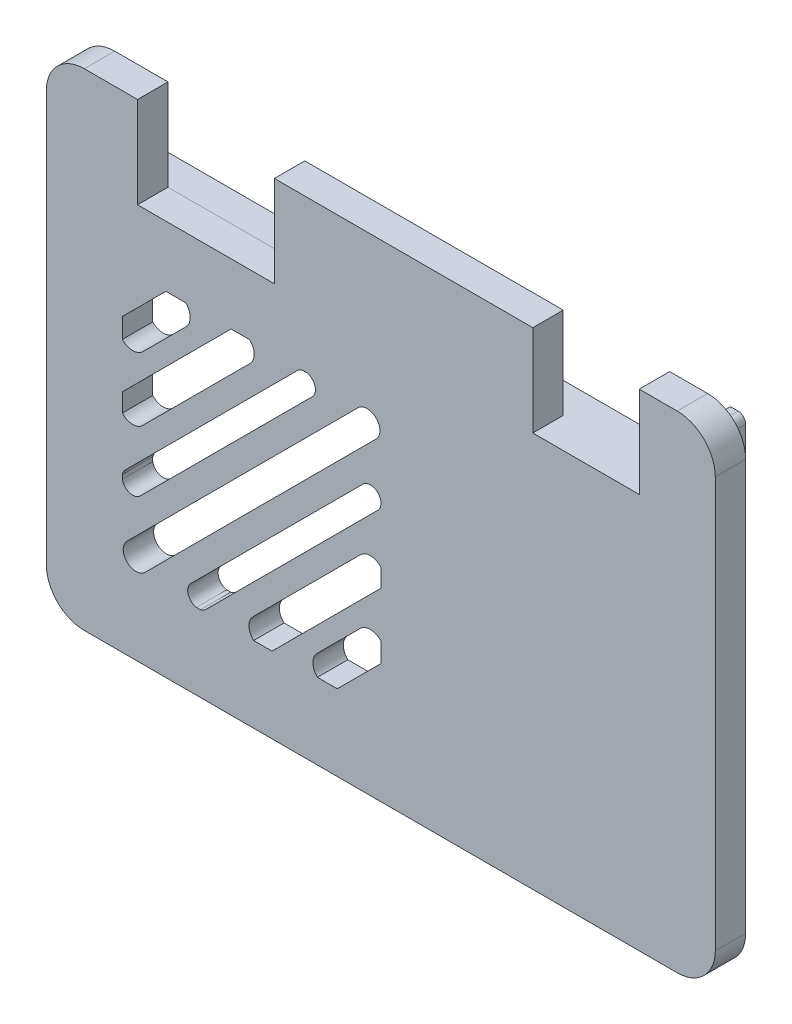
from build123d import *

# Parameters (mm, degrees)
BOSS_EXTRUDE1_DEPTH = 2
FILLET1_R           = 2.5
BOSS_EXTRUDE2_DEPTH = 2
SKETCH2_R           = 1.5
BOSS_EXTRUDE3_DEPTH = 2
CUT_EXTRUDE2_DEPTH  = 28.276363541


with BuildPart() as part:
    # Sketch1 → Boss-Extrude1 (new body)
    with BuildSketch(Plane.XY):
        Polygon((-16, 16), (-16, 10), (-7, 10), (-7, 16), (10, 16), (10, 10), (17, 10), (17, 16), (22, 16), (22, -16), (-22, -16), (-22, 16), align=None)
    extrude(amount=BOSS_EXTRUDE1_DEPTH)

    # Fillet1
    fillet1_edges = [part.edges().sort_by_distance(p)[0] for p in [
        (22, 16, 1),
        (22, -16, 1),
        (-22, -16, 1),
        (-22, 16, 1),
    ]]
    fillet(fillet1_edges, radius=FILLET1_R)

    # 3DSketch1 → Boss-Extrude2 (add)
    with BuildSketch(Plane(origin=(19, 14, 0), x_dir=(-0.3061688036461323, -0.9519772390524346, 0), z_dir=(0, 0, -1))):
        with BuildLine():
            Line((0, 0), (-0.153084402, -0.47598862))
            add(Edge.make_bspline(
                [(-0.153084402, -0.47598862), (-0.154868108, -0.481534737), (-0.156651815, -0.487080854), (-0.158392434, -0.492639968), (-0.163355767, -0.509395296), (-0.167155739, -0.526501552), (-0.169253431, -0.538016728), (-0.173612167, -0.566969771), (-0.176266082, -0.59605455), (-0.177180504, -0.613532189), (-0.177525116, -0.648499702), (-0.174644499, -0.683409069), (-0.172420113, -0.700798337), (-0.166447643, -0.735344283), (-0.157516697, -0.769221535), (-0.152320512, -0.785952341), (-0.140484535, -0.818917015), (-0.125796971, -0.85072523), (-0.117761661, -0.866298773), (-0.100350721, -0.896701834), (-0.080344616, -0.92545105), (-0.069720791, -0.939381409), (-0.047287637, -0.96629206), (-0.02259555, -0.991179427), (-0.009713163, -1.003069589), (0.016960573, -1.025557305), (0.045537286, -1.045470029), (0.060186839, -1.054787617), (0.085170858, -1.069361575), (0.111017614, -1.082497491), (0.121479589, -1.087420491), (0.137346952, -1.094165114), (0.153593984, -1.099798243), (0.158993372, -1.10157971), (0.164406594, -1.103320675), (0.169819816, -1.105061641)],
                knots=[0, 0, 0, 0, 0, 0, 0.037135921, 0.037135921, 0.037135921, 0.111407738, 0.111407738, 0.111407738, 0.222815464, 0.222815464, 0.222815464, 0.334223191, 0.334223191, 0.334223191, 0.445630917, 0.445630917, 0.445630917, 0.557038643, 0.557038643, 0.557038643, 0.668446369, 0.668446369, 0.668446369, 0.779854095, 0.779854095, 0.779854095, 0.890371976, 0.890371976, 0.890371976, 0.963753949, 0.963753949, 0.963753949, 1, 1, 1, 1, 1, 1], degree=5))
            Line((0.169819816, -1.105061641), (25.87320527, -9.371619339))
            add(Edge.make_bspline(
                [(25.87320527, -9.371619339), (25.878751387, -9.373403046), (25.884297505, -9.375186752), (25.889856619, -9.376927372), (25.906611947, -9.381890704), (25.923718203, -9.385690677), (25.935233379, -9.387788368), (25.964186422, -9.392147104), (25.993271201, -9.394801019), (26.01074884, -9.395715442), (26.045716353, -9.396060054), (26.08062572, -9.393179436), (26.098014987, -9.39095505), (26.132560934, -9.38498258), (26.166438186, -9.376051634), (26.183168991, -9.37085545), (26.216133666, -9.359019473), (26.247941881, -9.344331909), (26.263515424, -9.336296599), (26.293918485, -9.318885659), (26.3226677, -9.298879553), (26.33659806, -9.288255729), (26.36350871, -9.265822575), (26.388396077, -9.241130488), (26.40028624, -9.2282481), (26.422773956, -9.201574365), (26.44268668, -9.172997651), (26.452004268, -9.158348099), (26.466578225, -9.133364079), (26.479714142, -9.107517323), (26.484637141, -9.097055349), (26.491381765, -9.081187985), (26.497014894, -9.064940953), (26.49879636, -9.059541566), (26.500537326, -9.054128344), (26.502278292, -9.048715122)],
                knots=[0, 0, 0, 0, 0, 0, 0.037135921, 0.037135921, 0.037135921, 0.111407738, 0.111407738, 0.111407738, 0.222815464, 0.222815464, 0.222815464, 0.334223191, 0.334223191, 0.334223191, 0.445630917, 0.445630917, 0.445630917, 0.557038643, 0.557038643, 0.557038643, 0.668446369, 0.668446369, 0.668446369, 0.779854095, 0.779854095, 0.779854095, 0.890371976, 0.890371976, 0.890371976, 0.963753949, 0.963753949, 0.963753949, 1, 1, 1, 1, 1, 1], degree=5))
            Line((26.502278292, -9.048715122), (38.442861634, 28.078397201))
            add(Edge.make_bspline(
                [(38.442861634, 28.078397201), (38.44464534, 28.083943319), (38.446429047, 28.089489436), (38.448169666, 28.09504855), (38.453132999, 28.111803878), (38.456932971, 28.128910134), (38.459030663, 28.14042531), (38.463389399, 28.169378353), (38.466043314, 28.198463132), (38.466957736, 28.215940771), (38.467302348, 28.250908284), (38.464421731, 28.285817651), (38.462197345, 28.303206919), (38.456224875, 28.337752865), (38.447293929, 28.371630117), (38.442097744, 28.388360922), (38.430261767, 28.421325597), (38.415574203, 28.453133812), (38.407538893, 28.468707355), (38.390127953, 28.499110416), (38.370121848, 28.527859631), (38.359498023, 28.541789991), (38.337064869, 28.568700642), (38.312372782, 28.593588009), (38.299490395, 28.605478171), (38.272816659, 28.627965887), (38.244239946, 28.647878611), (38.229590393, 28.657196199), (38.204606374, 28.671770157), (38.178759618, 28.684906073), (38.168297643, 28.689829073), (38.15243028, 28.696573696), (38.136183248, 28.702206825), (38.13078386, 28.703988291), (38.125370638, 28.705729257), (38.119957416, 28.707470223)],
                knots=[0, 0, 0, 0, 0, 0, 0.037135921, 0.037135921, 0.037135921, 0.111407738, 0.111407738, 0.111407738, 0.222815464, 0.222815464, 0.222815464, 0.334223191, 0.334223191, 0.334223191, 0.445630917, 0.445630917, 0.445630917, 0.557038643, 0.557038643, 0.557038643, 0.668446369, 0.668446369, 0.668446369, 0.779854095, 0.779854095, 0.779854095, 0.890371976, 0.890371976, 0.890371976, 0.963753949, 0.963753949, 0.963753949, 1, 1, 1, 1, 1, 1], degree=5))
            Line((38.119957416, 28.707470223), (12.416571962, 36.974027921))
            add(Edge.make_bspline(
                [(12.416571962, 36.974027921), (12.411025845, 36.975811628), (12.405479727, 36.977595334), (12.399920613, 36.979335954), (12.383165285, 36.984299286), (12.366059029, 36.988099259), (12.354543853, 36.99019695), (12.32559081, 36.994555686), (12.296506031, 36.997209601), (12.279028392, 36.998124024), (12.244060879, 36.998468636), (12.209151512, 36.995588018), (12.191762245, 36.993363632), (12.157216298, 36.987391162), (12.123339046, 36.978460216), (12.106608241, 36.973264032), (12.073643566, 36.961428055), (12.041835352, 36.946740491), (12.026261808, 36.93870518), (11.995858747, 36.921294241), (11.967109532, 36.901288135), (11.953179172, 36.890664311), (11.926268522, 36.868231157), (11.901381155, 36.84353907), (11.889490992, 36.830656682), (11.867003276, 36.803982947), (11.847090552, 36.775406233), (11.837772964, 36.760756681), (11.823199007, 36.735772661), (11.81006309, 36.709925905), (11.805140091, 36.699463931), (11.798395467, 36.683596567), (11.792762338, 36.667349535), (11.790980872, 36.661950147), (11.789239906, 36.656536925), (11.78749894, 36.651123704)],
                knots=[0, 0, 0, 0, 0, 0, 0.037135921, 0.037135921, 0.037135921, 0.111407738, 0.111407738, 0.111407738, 0.222815464, 0.222815464, 0.222815464, 0.334223191, 0.334223191, 0.334223191, 0.445630917, 0.445630917, 0.445630917, 0.557038643, 0.557038643, 0.557038643, 0.668446369, 0.668446369, 0.668446369, 0.779854095, 0.779854095, 0.779854095, 0.890371976, 0.890371976, 0.890371976, 0.963753949, 0.963753949, 0.963753949, 1, 1, 1, 1, 1, 1], degree=5))
            Line((11.78749894, 36.651123704), (11.328245735, 35.223157845))
            Line((11.328245735, 35.223157845), (15.145810579, 33.995377166))
            Line((15.145810579, 33.995377166), (11.165616132, 21.619673058))
            Line((11.165616132, 21.619673058), (7.348051288, 22.847453737))
            Line((7.348051288, 22.847453737), (3.36785684, 10.47174963))
            Line((3.36785684, 10.47174963), (7.175765796, 9.247074415))
            Line((7.175765796, 9.247074415), (3.807908956, -1.224675215))
            Line((3.807908956, -1.224675215), (0, 0))
        make_face()
        Polygon((4.626002883, 11.117558065), (7.993859723, 21.589307695), (11.801768679, 20.36463248), (16.394300734, 34.644291066), (37.337799993, 27.908577386), (25.703385454, -8.266557698), (4.753303509, -1.551311707), (8.433911839, 9.89288285), align=None, mode=Mode.SUBTRACT)
    extrude(amount=BOSS_EXTRUDE2_DEPTH)

    # Sketch2 → Boss-Extrude3 (add)
    with BuildSketch(Plane(origin=(0, 0, 0), x_dir=(-1, 0, 0), z_dir=(0, 0, -1))):
        with Locations(Location((-13.010750093, 4, 0), (0, 0, 180))):
            Circle(SKETCH2_R)
        with Locations(Location((-13.010750093, -4, 0), (0, 0, 180))):
            Circle(SKETCH2_R)
    extrude(amount=BOSS_EXTRUDE3_DEPTH)

    # Sketch3 → Cut-Extrude2 (cut, through all)
    with BuildSketch(Plane(origin=(0, 0, 0), x_dir=(-1, 0, 0), z_dir=(0, 0, -1))):
        with BuildLine():
            ThreePointArc((2.845131762, -10.983295362), (2.853644927, -10.991701743), (2.862263518, -11))
            Line((2.862263518, -11), (4.168477106, -11))
            ThreePointArc((4.168477106, -11), (4.463155252, -10.325020737), (4.185608862, -9.642818263))
            Line((4.185608862, -9.642818263), (1.357181737, -6.814391138))
            ThreePointArc((1.357181737, -6.814391138), (0.674979263, -6.536844748), (0, -6.831522894))
            Line((0, -6.831522894), (0, -8.137736482))
            ThreePointArc((0, -8.137736482), (0.008298257, -8.146355073), (0.016704638, -8.154868238))
            Line((0.016704638, -8.154868238), (2.845131762, -10.983295362))
        make_face()
        with BuildLine():
            ThreePointArc((7.111571301, -10.959496511), (7.132851692, -10.980098346), (7.1547883, -11))
            Line((7.1547883, -11), (8.361233698, -11))
            ThreePointArc((8.361233698, -11), (8.671734976, -10.342672018), (8.404450697, -9.666617114))
            Line((8.404450697, -9.666617114), (1.333382886, -2.595549303))
            ThreePointArc((1.333382886, -2.595549303), (0.657327982, -2.328265024), (0, -2.638766302))
            Line((0, -2.638766302), (0, -3.8452117))
            ThreePointArc((0, -3.8452117), (0.019901654, -3.867148308), (0.040503489, -3.888428699))
            Line((0.040503489, -3.888428699), (7.111571301, -10.959496511))
        make_face()
        with BuildLine():
            ThreePointArc((11.506206979, -10.80750152), (11.673636816, -10.931128339), (11.870037007, -11))
            Line((11.870037007, -11), (12.131266365, -11))
            ThreePointArc((12.131266365, -11), (12.668928686, -10.518864948), (12.495096394, -9.818612105))
            Line((12.495096394, -9.818612105), (1.181387895, 1.495096394))
            ThreePointArc((1.181387895, 1.495096394), (0.481135052, 1.668928686), (0, 1.131266365))
            Line((0, 1.131266365), (0, 0.870037007))
            ThreePointArc((0, 0.870037007), (0.068871661, 0.673636816), (0.19249848, 0.506206979))
            Line((0.19249848, 0.506206979), (11.506206979, -10.80750152))
        make_face()
        with BuildLine():
            Line((16.695499788, -9.507296008), (1.492703992, 5.695499788))
            ThreePointArc((1.492703992, 5.695499788), (0.304500212, 5.695499788), (0.304500212, 4.507296008))
            Line((0.304500212, 4.507296008), (15.507296008, -10.695499788))
            ThreePointArc((15.507296008, -10.695499788), (16.695499788, -10.695499788), (16.695499788, -9.507296008))
        make_face()
        with BuildLine():
            ThreePointArc((15.818612105, -6.495096394), (16.518864948, -6.668928686), (17, -6.131266365))
            Line((17, -6.131266365), (17, -5.870037007))
            ThreePointArc((17, -5.870037007), (16.931128339, -5.673636816), (16.80750152, -5.506206979))
            Line((16.80750152, -5.506206979), (5.493793021, 5.80750152))
            ThreePointArc((5.493793021, 5.80750152), (5.326363184, 5.931128339), (5.129962993, 6))
            Line((5.129962993, 6), (4.868733635, 6))
            ThreePointArc((4.868733635, 6), (4.331071314, 5.518864948), (4.504903606, 4.818612105))
            Line((4.504903606, 4.818612105), (15.818612105, -6.495096394))
        make_face()
        with BuildLine():
            ThreePointArc((15.666617114, -2.404450697), (16.342672018, -2.671734976), (17, -2.361233698))
            Line((17, -2.361233698), (17, -1.1547883))
            ThreePointArc((17, -1.1547883), (16.980098346, -1.132851692), (16.959496511, -1.111571301))
            Line((16.959496511, -1.111571301), (9.888428699, 5.959496511))
            ThreePointArc((9.888428699, 5.959496511), (9.867148308, 5.980098346), (9.8452117, 6))
            Line((9.8452117, 6), (8.638766302, 6))
            ThreePointArc((8.638766302, 6), (8.328265024, 5.342672018), (8.595549303, 4.666617114))
            Line((8.595549303, 4.666617114), (15.666617114, -2.404450697))
        make_face()
        with BuildLine():
            ThreePointArc((15.642818263, 1.814391138), (16.325020737, 1.536844748), (17, 1.831522894))
            Line((17, 1.831522894), (17, 3.137736482))
            ThreePointArc((17, 3.137736482), (16.991701743, 3.146355073), (16.983295362, 3.154868238))
            Line((16.983295362, 3.154868238), (14.154868238, 5.983295362))
            ThreePointArc((14.154868238, 5.983295362), (14.146355073, 5.991701743), (14.137736482, 6))
            Line((14.137736482, 6), (12.831522894, 6))
            ThreePointArc((12.831522894, 6), (12.536844748, 5.325020737), (12.814391138, 4.642818263))
            Line((12.814391138, 4.642818263), (15.642818263, 1.814391138))
        make_face()
    extrude(amount=-CUT_EXTRUDE2_DEPTH, mode=Mode.SUBTRACT)


solid = part.part
